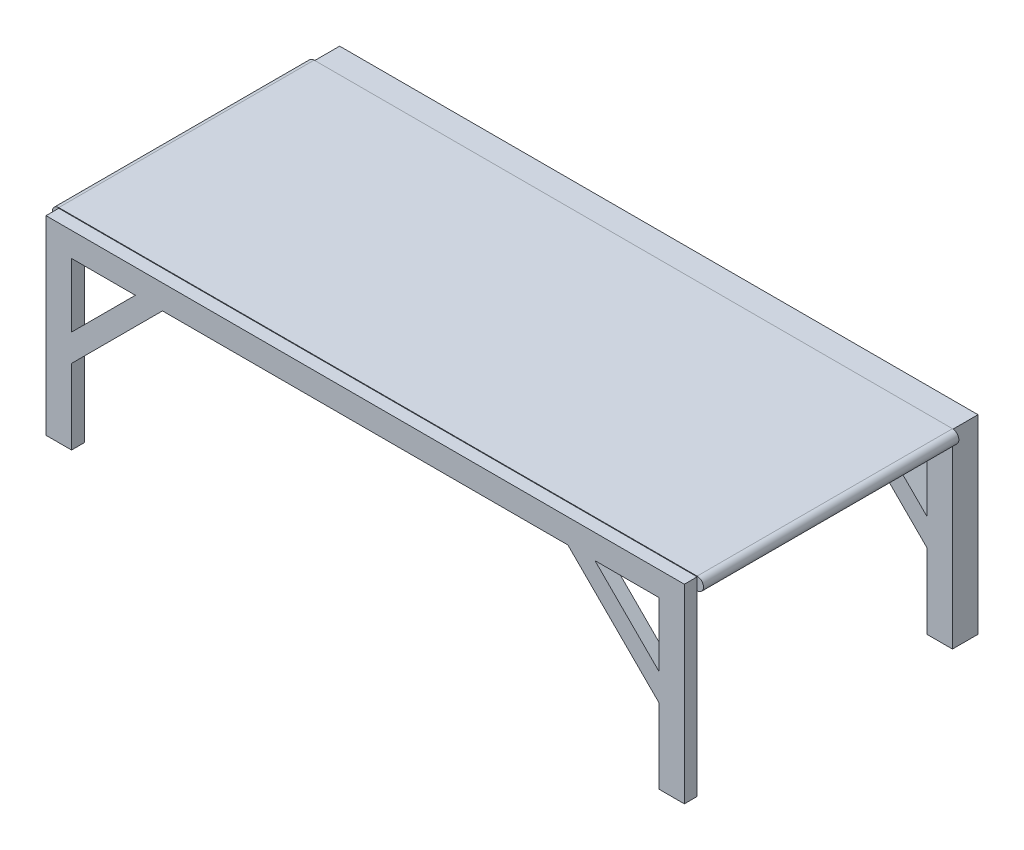
from build123d import *

# Parameters (mm, degrees)
EXTRUDE_1_DEPTH = 200
SKETCH_2_W      = 1000
SKETCH_2_H      = 18
EXTRUDE_2_DEPTH = 20
EXTRUDE_3_DEPTH = 20
EXTRUDE_START   = -400
SKETCH_2_2_W    = 1000
SKETCH_2_2_H    = 18
EXTRUDE_4_DEPTH = 40
EXTRUDE_START_2 = -460
EXTRUDE_5_DEPTH = 40


with BuildPart() as part:
    # 草图1 → 凸台-拉伸1 (new, symmetric)
    with BuildSketch(Plane.XY):
        with BuildLine():
            Line((0, 10), (1000, 10))
            ThreePointArc((1000, 10), (1010, 0), (1000, -10))
            Line((1000, -10), (0, -10))
            ThreePointArc((0, -10), (-10, 0), (0, 10))
        make_face()
    extrude(amount=EXTRUDE_1_DEPTH, both=True)


with BuildPart() as body_2:
    # 草图2 → 凸台-拉伸2 (new body)
    with BuildSketch(Plane.XY.offset(200)):
        with Locations((500, 0)):
            Rectangle(SKETCH_2_W, SKETCH_2_H)
    extrude(amount=EXTRUDE_2_DEPTH)

    # 草图3 → 凸台-拉伸3 (add)
    with BuildSketch(Plane.XY.offset(220)):
        Polygon((0, -9), (0, -289), (40, -289), (40, -171.426406871), (182.426406871, -29), (817.573593129, -29), (960, -171.426406871), (960, -289), (1000, -289), (1000, -9), align=None)
        Polygon((40, -29), (40, -129), (140, -29), align=None, mode=Mode.SUBTRACT)
        Polygon((960, -129), (860, -29), (960, -29), align=None, mode=Mode.SUBTRACT)
    extrude(amount=-EXTRUDE_3_DEPTH)


with BuildPart() as body_3:
    # 草图2<2> → 凸台-拉伸4 (new body)
    with BuildSketch(Plane.XY.offset(200).offset(EXTRUDE_START)):
        with Locations((500, 0)):
            Rectangle(SKETCH_2_2_W, SKETCH_2_2_H)
    extrude(amount=-EXTRUDE_4_DEPTH)

    # 草图3<2> → 凸台-拉伸5 (add)
    with BuildSketch(Plane.XY.offset(220).offset(EXTRUDE_START_2)):
        Polygon((0, -9), (0, -289), (40, -289), (40, -171.426406871), (182.426406871, -29), (817.573593129, -29), (960, -171.426406871), (960, -289), (1000, -289), (1000, -9), align=None)
        Polygon((40, -29), (40, -129), (140, -29), align=None, mode=Mode.SUBTRACT)
        Polygon((960, -129), (860, -29), (960, -29), align=None, mode=Mode.SUBTRACT)
    extrude(amount=EXTRUDE_5_DEPTH)


solid = Compound([part.part, body_2.part, body_3.part])
